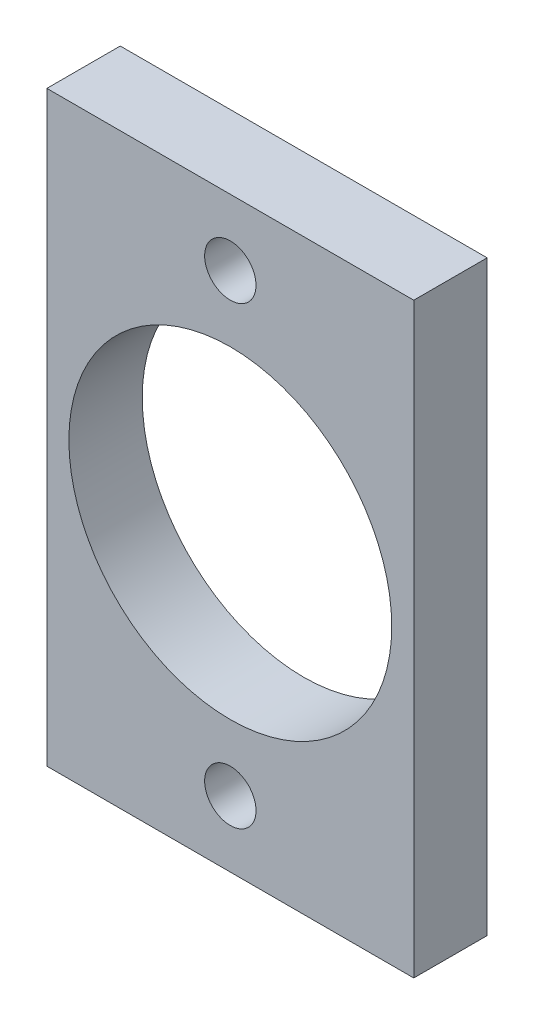
from build123d import *

# Parameters (mm, degrees)
SKETCH1_W           = 25
SKETCH1_H           = 40
SKETCH1_R           = 11
SKETCH1_R_2         = 1.75
BOSS_EXTRUDE1_DEPTH = 5


with BuildPart() as part:
    # Sketch1 → Boss-Extrude1 (new body)
    with BuildSketch(Plane.XY):
        with Locations((31.915591248, 315)):
            Rectangle(SKETCH1_W, SKETCH1_H)
        with Locations((31.915591248, 315)):
            Circle(SKETCH1_R, mode=Mode.SUBTRACT)
        with Locations((31.915591248, 330.5)):
            Circle(SKETCH1_R_2, mode=Mode.SUBTRACT)
        with Locations((31.915591248, 299.5)):
            Circle(SKETCH1_R_2, mode=Mode.SUBTRACT)
    extrude(amount=BOSS_EXTRUDE1_DEPTH)


solid = part.part
